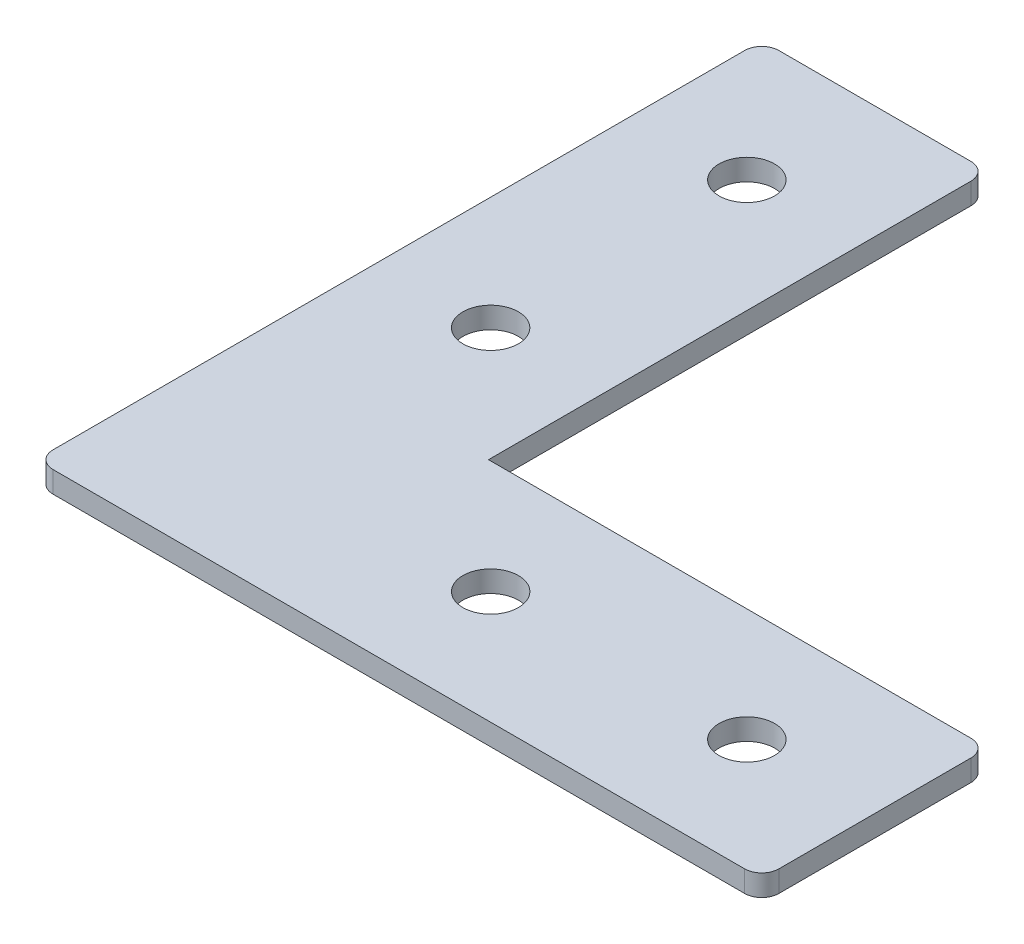
from build123d import *

# Parameters (mm, degrees)
BOSS_EXTRUDE1_DEPTH = 2.5
SKETCH2_R           = 3.25
CUT_EXTRUDE1_DEPTH  = 121.234146564
FILLET1_R           = 2


with BuildPart() as part:
    # Sketch1 → Boss-Extrude1 (new body)
    with BuildSketch(Plane(origin=(0, 0, 0), x_dir=(1, 0, 0), z_dir=(0, 1, 0))):
        Polygon((0, 0), (85, 0), (85, 26.5), (26.5, 26.5), (26.5, 85), (0, 85), align=None)
    extrude(amount=BOSS_EXTRUDE1_DEPTH)

    # Sketch2 → Cut-Extrude1 (cut, through all)
    with BuildSketch(Plane(origin=(0, 2.5, 0), x_dir=(1, 0, 0), z_dir=(0, 1, 0))):
        with Locations(Location((13.25, 70, 0), (0, 0, 270))):
            Circle(SKETCH2_R)
        with Locations(Location((13.25, 40, 0), (0, 0, 270))):
            Circle(SKETCH2_R)
        with Locations(Location((70, 13.25, 0), (0, 0, 270))):
            Circle(SKETCH2_R)
        with Locations(Location((40, 13.25, 0), (0, 0, 270))):
            Circle(SKETCH2_R)
    extrude(amount=-CUT_EXTRUDE1_DEPTH, mode=Mode.SUBTRACT)

    # Fillet1
    fillet1_edges = [part.edges().sort_by_distance(p)[0] for p in [
        (0, 1.25, 0),
        (0, 1.25, -85),
        (26.5, 1.25, -85),
        (85, 1.25, -26.5),
        (85, 1.25, 0),
    ]]
    fillet(fillet1_edges, radius=FILLET1_R)


solid = part.part
